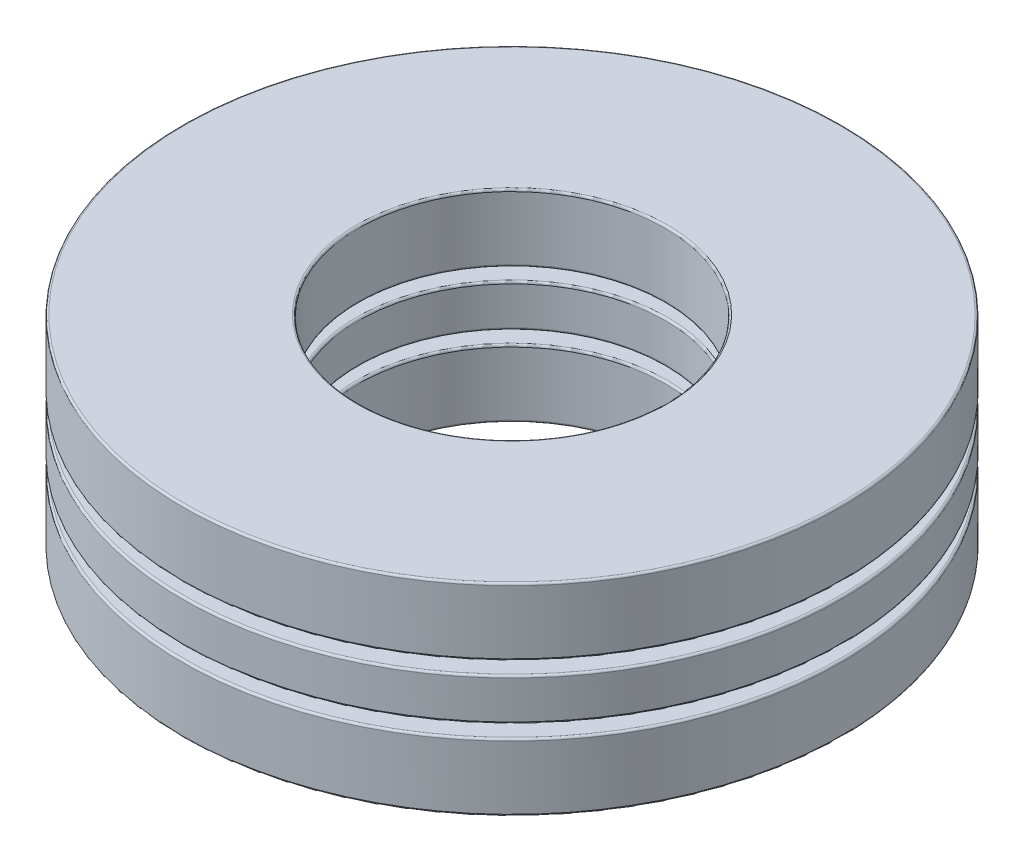
from build123d import *

# Parameters (mm, degrees)
SKETCH1_W         = 5.51815
SKETCH1_H         = 1.317625
CIRPATTERN1_COUNT = 4
CIRPATTERN1_ANGLE = 270
CIRPATTERN2_COUNT = 4
SKETCH4_W         = 5.51815
SKETCH4_H         = 2.1082
FILLET1_R         = 0.063246
FILLET2_R         = 0.063246
FILLET3_R         = 0.063246


with BuildPart() as part:
    # Sketch1 → Revolve1 (revolve)
    with BuildSketch(Plane(origin=(0, 0, 0), x_dir=(0, 0, -1), z_dir=(1, 0, 0)), mode=Mode.PRIVATE) as revolve1_sk:
        with Locations((-7.559675, 0)):
            Rectangle(SKETCH1_W, SKETCH1_H)
    revolve(revolve1_sk.sketch.rotate(Axis((0, -3.1623, 0), (0, 1, 0)), 180), axis=Axis((0, -3.1623, 0), (0, 1, 0)))

    # Sketch3 → Cut-Revolve1 (revolve, cut)
    with BuildSketch(Plane(origin=(0, 0, 0), x_dir=(0, 0, -1), z_dir=(1, 0, 0))):
        with BuildLine():
            Line((-7.559675, 1.0541), (-7.559675, -1.0541))
            ThreePointArc((-7.559675, -1.0541), (-8.613775, 0), (-7.559675, 1.0541))
        make_face()
    cut_revolve1 = revolve(axis=Axis((0, 1.0541, 7.559675), (0, -1, 0)), mode=Mode.SUBTRACT)

    # CirPattern2: Cut-Revolve1 ×4 about axis
    cirpattern2_axis = Axis((0, 0, 0), (0, 1, 0))
    for i in range(1, CIRPATTERN2_COUNT):
        add(cut_revolve1.rotate(cirpattern2_axis, i * 360 / CIRPATTERN2_COUNT), mode=Mode.SUBTRACT)

    # Fillet2
    fillet2_edges = [part.edges().sort_by_distance(p)[0] for p in [
        (0, 0.6588125, 10.31875),
        (0, 0.6588125, 4.8006),
        (0, -0.6588125, 4.8006),
        (0, -0.6588125, 10.31875),
    ]]
    fillet(fillet2_edges, radius=FILLET2_R)


with BuildPart() as body_2:
    # Sketch2 → Revolve2 (revolve)
    with BuildSketch(Plane(origin=(0, 0, 0), x_dir=(0, 0, -1), z_dir=(1, 0, 0))):
        with BuildLine():
            Line((-7.559675, 1.0541), (-7.559675, -1.0541))
            ThreePointArc((-7.559675, -1.0541), (-8.613775, 0), (-7.559675, 1.0541))
        make_face()
    revolve(axis=Axis((0, 1.0541, 7.559675), (0, -1, 0)))


with BuildPart() as cirpattern1_1:
    # CirPattern1: pattern copy
    add(body_2.part.rotate(Axis((0, 3.1623, 0), (0, -1, 0)), 1 * CIRPATTERN1_ANGLE / (CIRPATTERN1_COUNT - 1)))


with BuildPart() as cirpattern1_2:
    # CirPattern1: pattern copy
    add(body_2.part.rotate(Axis((0, 3.1623, 0), (0, -1, 0)), 2 * CIRPATTERN1_ANGLE / (CIRPATTERN1_COUNT - 1)))


with BuildPart() as cirpattern1_3:
    # CirPattern1: pattern copy
    add(body_2.part.rotate(Axis((0, 3.1623, 0), (0, -1, 0)), 3 * CIRPATTERN1_ANGLE / (CIRPATTERN1_COUNT - 1)))


with BuildPart() as body_6:
    # Sketch4 → Revolve3 (revolve)
    with BuildSketch(Plane(origin=(0, 0, 0), x_dir=(0, 0, -1), z_dir=(1, 0, 0)), mode=Mode.PRIVATE) as revolve3_sk:
        with Locations((-7.559675, 2.1082)):
            Rectangle(SKETCH4_W, SKETCH4_H)
        with Locations((-7.559675, -2.1082)):
            Rectangle(SKETCH4_W, SKETCH4_H)
    revolve(revolve3_sk.sketch.rotate(Axis((0, -3.1623, 0), (0, 1, 0)), 180), axis=Axis((0, -3.1623, 0), (0, 1, 0)))

    # Fillet1
    fillet1_edges = [body_6.edges().sort_by_distance(p)[0] for p in [
        (0, 1.0541, 10.31875),
        (0, 1.0541, 4.8006),
        (0, 3.1623, 4.8006),
        (0, 3.1623, 10.31875),
    ]]
    fillet(fillet1_edges, radius=FILLET1_R)

    # Fillet3
    fillet3_edges = [body_6.edges().sort_by_distance(p)[0] for p in [
        (0, -3.1623, 10.31875),
        (0, -3.1623, 4.8006),
        (0, -1.0541, 4.8006),
        (0, -1.0541, 10.31875),
    ]]
    fillet(fillet3_edges, radius=FILLET3_R)


solid = Compound([part.part, body_2.part, cirpattern1_1.part, cirpattern1_2.part, cirpattern1_3.part, body_6.part])
